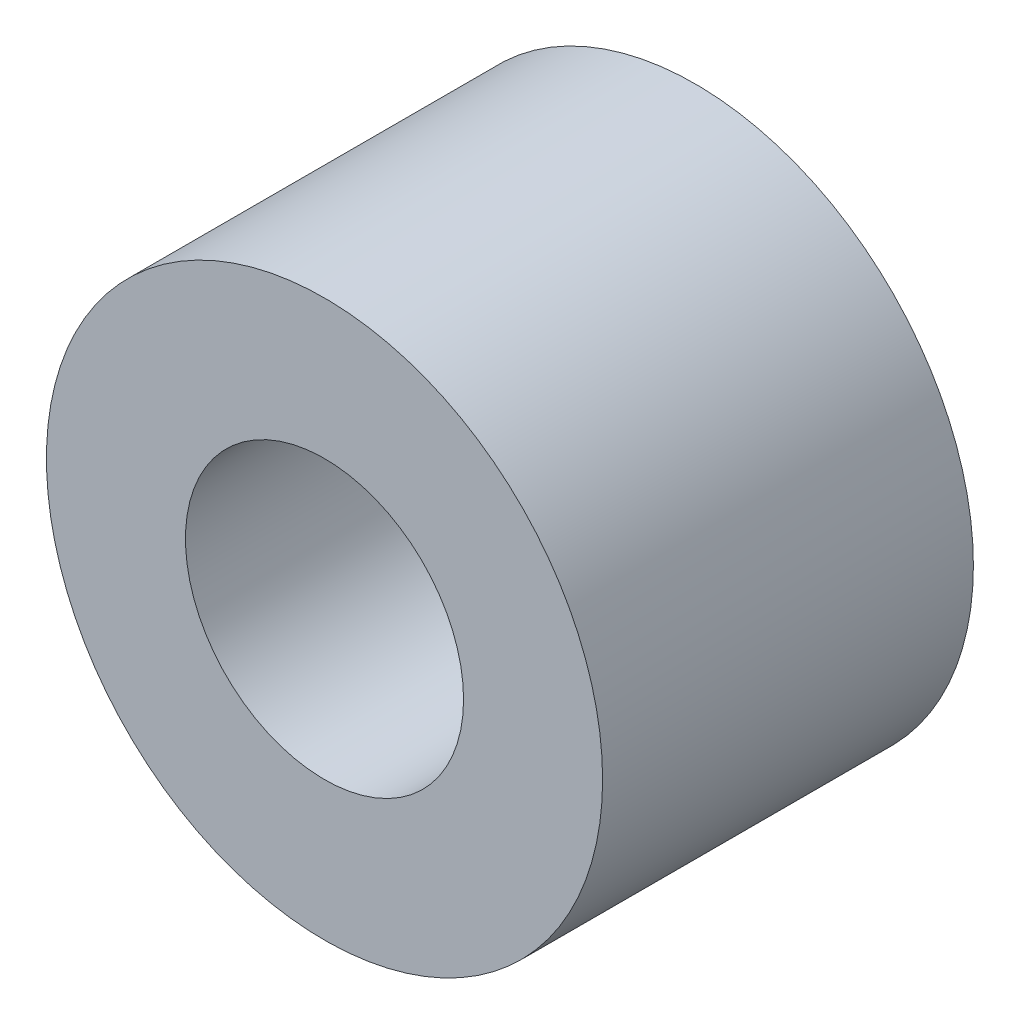
from build123d import *

# Parameters (mm, degrees)
SKETCH1_R           = 1.5
SKETCH1_R_2         = 0.75
BOSS_EXTRUDE1_DEPTH = 2


with BuildPart() as part:
    # Sketch1 → Boss-Extrude1 (new body)
    with BuildSketch(Plane.XY):
        Circle(SKETCH1_R)
        Circle(SKETCH1_R_2, mode=Mode.SUBTRACT)
    extrude(amount=BOSS_EXTRUDE1_DEPTH)


solid = part.part
